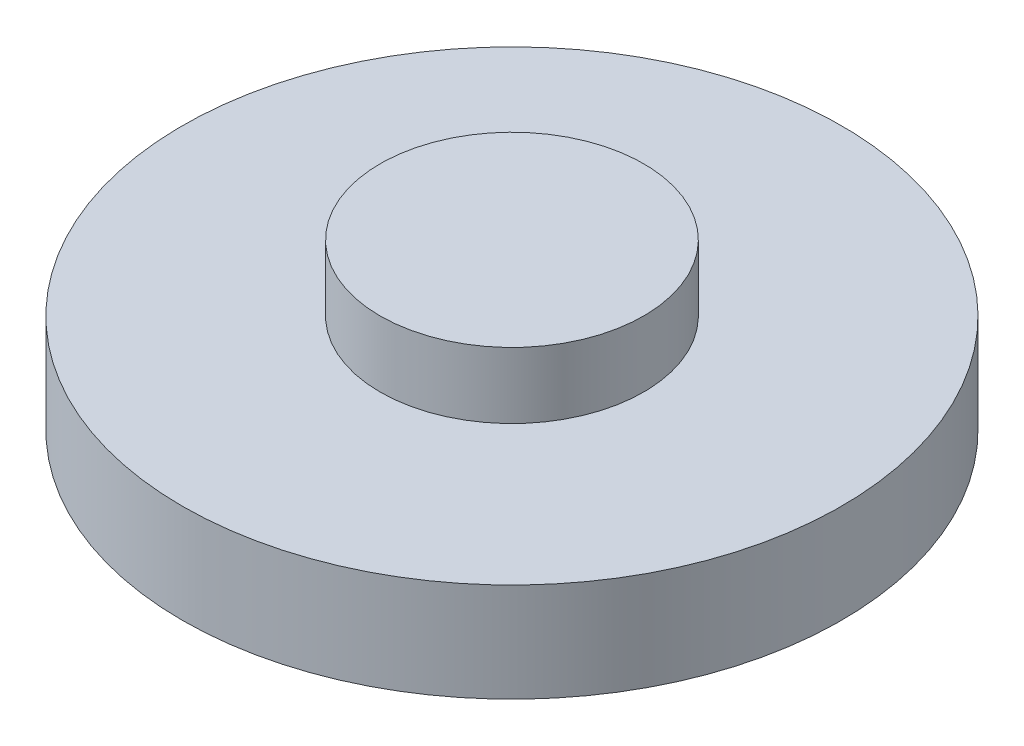
from build123d import *

# Parameters (mm, degrees)
SKETCH_2_R          = 50
EXTRUDE_1_DEPTH     = 15
SKETCH_5_R          = 20
EXTRUDE_2_DEPTH     = 10
SKETCH_6_R          = 1.5
CUT_EXTRUDE_1_DEPTH = 7


with BuildPart() as part:
    # Эскиз2 → Бобышка-Вытянуть1 (new body)
    with BuildSketch(Plane(origin=(0, 0, 0), x_dir=(1, 0, 0), z_dir=(0, 1, 0))):
        with Locations(Location((0, 0, 0), (0, 0, 270))):
            Circle(SKETCH_2_R)
    extrude(amount=EXTRUDE_1_DEPTH)

    # Эскиз5 → Бобышка-Вытянуть2 (add)
    with BuildSketch(Plane(origin=(0, 15, 0), x_dir=(1, 0, 0), z_dir=(0, 1, 0))):
        with Locations(Location((0, 0, 0), (0, 0, 270))):
            Circle(SKETCH_5_R)
    extrude(amount=EXTRUDE_2_DEPTH)

    # Эскиз6 → Вырез-Вытянуть1 (cut)
    with BuildSketch(Plane.XZ):
        with Locations(Location((31.93, 9, 0), (0, 0, 270))):
            Circle(SKETCH_6_R)
        with Locations(Location((31.93, -9, 0), (0, 0, 270))):
            Circle(SKETCH_6_R)
        with Locations(Location((-31.925, 9, 0), (0, 0, 270))):
            Circle(SKETCH_6_R)
        with Locations(Location((-31.925, -9, 0), (0, 0, 270))):
            Circle(SKETCH_6_R)
    extrude(amount=-CUT_EXTRUDE_1_DEPTH, mode=Mode.SUBTRACT)


solid = part.part
